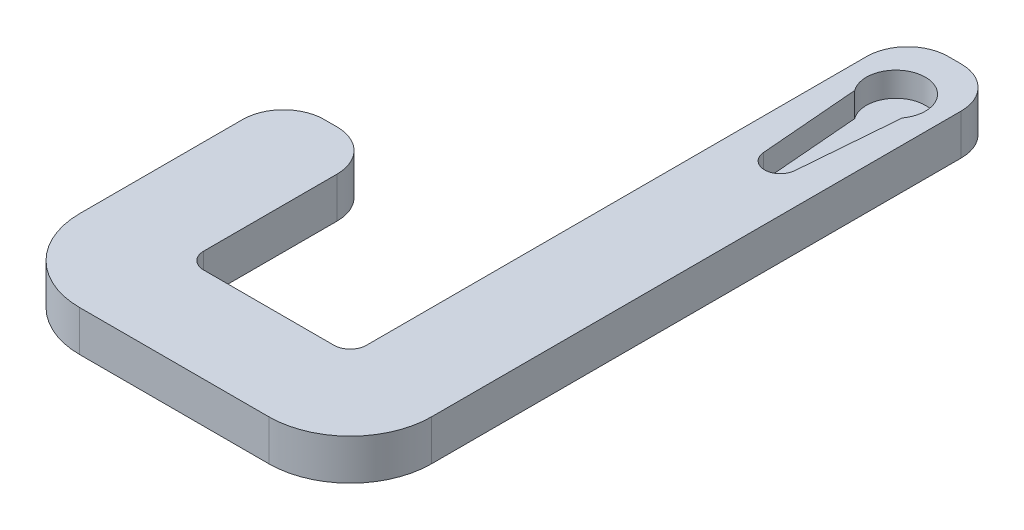
from build123d import *

# Parameters (mm, degrees)
BOSS_EXTRUDE1_DEPTH = 5
CUT_EXTRUDE3_DEPTH  = 3
FILLET1_R           = 5
FILLET2_R           = 10
FILLET3_R           = 5
FILLET4_R           = 2


with BuildPart() as part:
    # Sketch1 → Boss-Extrude1 (new body)
    with BuildSketch(Plane(origin=(0, 0, 0), x_dir=(1, 0, 0), z_dir=(0, 1, 0))):
        Polygon((0, 5.8), (20, 5.8), (20, 74.2), (31.6, 74.2), (31.6, 5.8), (31.6, -5.8), (20, -5.8), (0, -5.8), (-11.6, -5.8), (-11.6, 29.2), (0, 29.2), align=None)
    extrude(amount=BOSS_EXTRUDE1_DEPTH)

    # Sketch2 → Cut-Extrude3 (cut)
    with BuildSketch(Plane(origin=(0, 5, 0), x_dir=(1, 0, 0), z_dir=(0, 1, 0))):
        with BuildLine():
            Line((28.721, 64.841739258), (27.723587356, 52.636800493))
            ThreePointArc((27.723587356, 52.636800493), (25.8, 50.864), (23.876412644, 52.636800493))
            Line((23.876412644, 52.636800493), (22.879, 64.841739258))
            ThreePointArc((22.879, 64.841739258), (25.8, 70.6), (28.721, 64.841739258))
        make_face()
    extrude(amount=-CUT_EXTRUDE3_DEPTH, mode=Mode.SUBTRACT)

    # Fillet1
    fillet1_edges = [part.edges().sort_by_distance(p)[0] for p in [
        (20, 2.5, -74.2),
        (31.6, 2.5, -74.2),
    ]]
    fillet(fillet1_edges, radius=FILLET1_R)

    # Fillet2
    fillet2_edges = [part.edges().sort_by_distance(p)[0] for p in [
        (-11.6, 2.5, 5.8),
        (31.6, 2.5, 5.8),
    ]]
    fillet(fillet2_edges, radius=FILLET2_R)

    # Fillet3
    fillet3_edges = [part.edges().sort_by_distance(p)[0] for p in [
        (0, 2.5, -29.2),
        (-11.6, 2.5, -29.2),
    ]]
    fillet(fillet3_edges, radius=FILLET3_R)

    # Fillet4
    fillet4_edges = [part.edges().sort_by_distance(p)[0] for p in [
        (0, 2.5, -5.8),
        (20, 2.5, -5.8),
    ]]
    fillet(fillet4_edges, radius=FILLET4_R)


solid = part.part
